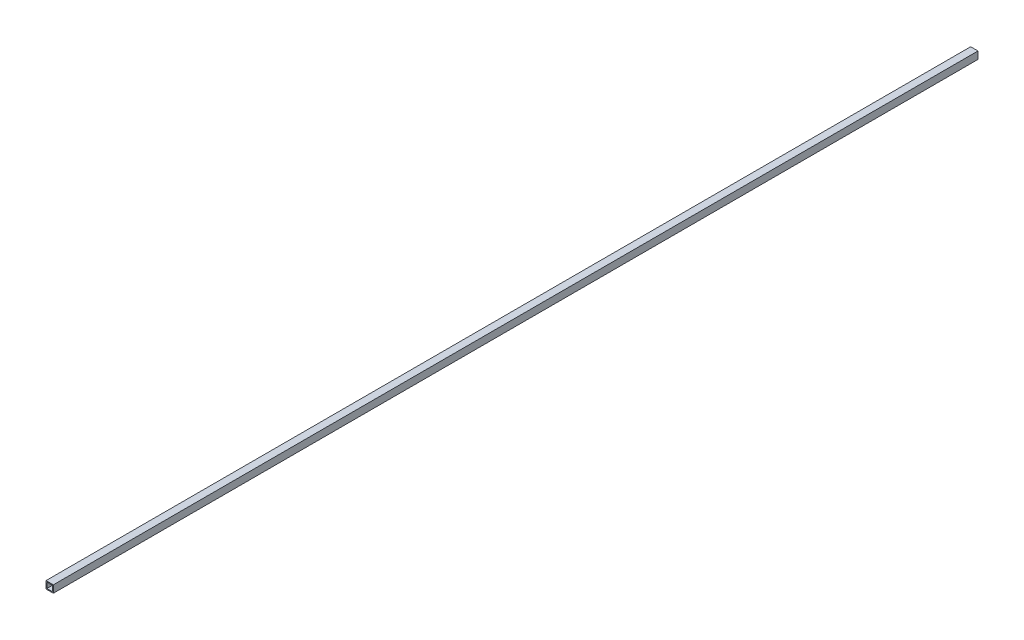
from build123d import *

# Parameters (mm, degrees)
SKETCH1_W           = 12.7
SKETCH1_H           = 12.7
SKETCH1_W_2         = 9.525
SKETCH1_H_2         = 9.525
BOSS_EXTRUDE1_DEPTH = 1600


with BuildPart() as part:
    # Sketch1 → Boss-Extrude1 (new body)
    with BuildSketch(Plane.XY):
        Rectangle(SKETCH1_W, SKETCH1_H)
        Rectangle(SKETCH1_W_2, SKETCH1_H_2, mode=Mode.SUBTRACT)
    extrude(amount=BOSS_EXTRUDE1_DEPTH)


solid = part.part
